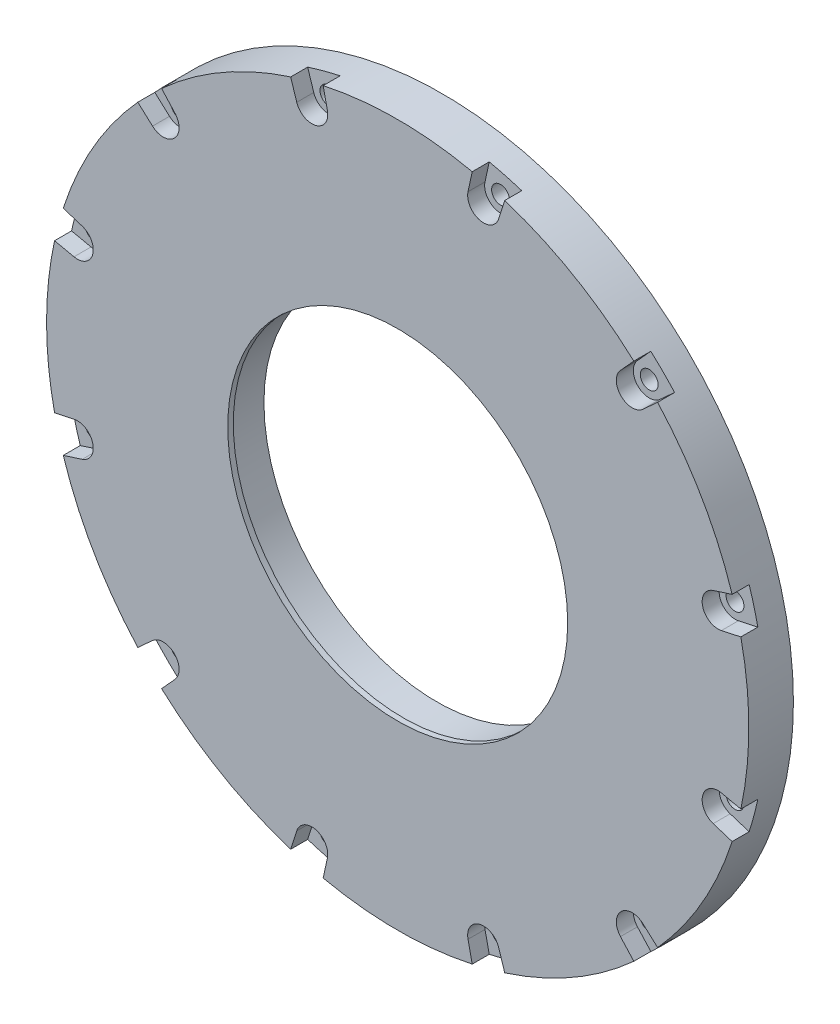
from build123d import *

# Parameters (mm, degrees)
CYC_MASTER_SKETCH_R          = 39.15
BOSS_EXTRUDE1_DEPTH          = 8
SKETCH3_R                    = 1.575
PIN_CUTOUT_DEPTH             = 4
SKETCH5_R                    = 31
CUT_EXTRUDE2_DEPTH           = 56.941442598
BOSS_EXTRUDE2_START          = -1
SKETCH6_R                    = 31
SKETCH6_R_2                  = 30.5
BOSS_EXTRUDE2_DEPTH          = 1
SKETCH7_R                    = 63
SKETCH7_R_2                  = 39.15
BOSS_EXTRUDE3_DEPTH          = 8
SKETCH8_R                    = 36.5
CUT_EXTRUDE3_DEPTH           = 1
M3_START                     = -8
SKETCH9_R                    = 2.1
M3_L5_7_INSERT_CUTOUT_DEPTH  = 6
SKETCH19_R                   = 1.6
M3_THRU_DEPTH                = 90.453898741
M3_START_2                   = -3.05
M3_SOCKET_HEAD_CAP_CUT_DEPTH = 3.05


with BuildPart() as part:
    # CYC Master Sketch → Boss-Extrude1 (new body)
    with BuildSketch(Plane.XY.offset(19)):
        Circle(CYC_MASTER_SKETCH_R)
    extrude(amount=BOSS_EXTRUDE1_DEPTH)

    # Sketch3 → Pin Cutout (cut)
    with BuildSketch(Plane(origin=(0, 0, 19), x_dir=(-1, 0, 0), z_dir=(0, 0, -1))):
        with Locations((-33.5, 0)):
            Circle(SKETCH3_R)
        with Locations((-32.358515181, 8.670438011)):
            Circle(SKETCH3_R)
        with Locations((-29.011851027, 16.75)):
            Circle(SKETCH3_R)
        with Locations((-23.68807717, 23.68807717)):
            Circle(SKETCH3_R)
        with Locations((-16.75, 29.011851027)):
            Circle(SKETCH3_R)
        with Locations((-8.670438011, 32.358515181)):
            Circle(SKETCH3_R)
        with Locations((0, 33.5)):
            Circle(SKETCH3_R)
        with Locations((8.670438011, 32.358515181)):
            Circle(SKETCH3_R)
        with Locations((16.75, 29.011851027)):
            Circle(SKETCH3_R)
        with Locations((23.68807717, 23.68807717)):
            Circle(SKETCH3_R)
        with Locations((29.011851027, 16.75)):
            Circle(SKETCH3_R)
        with Locations((32.358515181, 8.670438011)):
            Circle(SKETCH3_R)
        with Locations((33.5, 0)):
            Circle(SKETCH3_R)
        with Locations((32.358515181, -8.670438011)):
            Circle(SKETCH3_R)
        with Locations((29.011851027, -16.75)):
            Circle(SKETCH3_R)
        with Locations((23.68807717, -23.68807717)):
            Circle(SKETCH3_R)
        with Locations((16.75, -29.011851027)):
            Circle(SKETCH3_R)
        with Locations((8.670438011, -32.358515181)):
            Circle(SKETCH3_R)
        with Locations((0, -33.5)):
            Circle(SKETCH3_R)
        with Locations((-8.670438011, -32.358515181)):
            Circle(SKETCH3_R)
        with Locations((-16.75, -29.011851027)):
            Circle(SKETCH3_R)
        with Locations((-23.68807717, -23.68807717)):
            Circle(SKETCH3_R)
        with Locations((-29.011851027, -16.75)):
            Circle(SKETCH3_R)
        with Locations((-32.358515181, -8.670438011)):
            Circle(SKETCH3_R)
    extrude(amount=-PIN_CUTOUT_DEPTH, mode=Mode.SUBTRACT)

    # Sketch5 → Cut-Extrude2 (cut, through all)
    with BuildSketch(Plane(origin=(0, 0, 19), x_dir=(-1, 0, 0), z_dir=(0, 0, -1))):
        Circle(SKETCH5_R)
    extrude(amount=-CUT_EXTRUDE2_DEPTH, mode=Mode.SUBTRACT)

    # Sketch6 → Boss-Extrude2 (add)
    with BuildSketch(Plane.XY.offset(27).offset(BOSS_EXTRUDE2_START)):
        with Locations(Location((0, 0, 0), (0, 0, 180))):
            Circle(SKETCH6_R)
        Circle(SKETCH6_R_2, mode=Mode.SUBTRACT)
    extrude(amount=BOSS_EXTRUDE2_DEPTH)

    # Sketch7 → Boss-Extrude3 (add)
    with BuildSketch(Plane(origin=(0, 0, 19), x_dir=(-1, 0, 0), z_dir=(0, 0, -1))):
        Circle(SKETCH7_R)
        Circle(SKETCH7_R_2, mode=Mode.SUBTRACT)
    extrude(amount=-BOSS_EXTRUDE3_DEPTH)

    # Sketch8 → Cut-Extrude3 (cut)
    with BuildSketch(Plane(origin=(0, 0, 19), x_dir=(-1, 0, 0), z_dir=(0, 0, -1))):
        Circle(SKETCH8_R)
    extrude(amount=-CUT_EXTRUDE3_DEPTH, mode=Mode.SUBTRACT)

    # Sketch9 → M3 L5.7 Insert Cutout (cut)
    with BuildSketch(Plane.XY.offset(27).offset(M3_START)):
        with Locations(Location((-33.028693287, -13.680932707, 0), (0, 0, 131.860967074))):
            Circle(SKETCH9_R)
        with Locations(Location((-28.362381915, -21.763221087, 0), (0, 0, 146.860967074))):
            Circle(SKETCH9_R)
        with Locations(Location((-28.362381915, 21.763221087, 0), (0, 0, 213.139032926))):
            Circle(SKETCH9_R)
        with Locations(Location((-33.028693287, 13.680932707, 0), (0, 0, 228.139032926))):
            Circle(SKETCH9_R)
        with Locations(Location((4.666311372, 35.444153794, 0), (0, 0, 153.139032926))):
            Circle(SKETCH9_R)
        with Locations(Location((-4.666311372, 35.444153794, 0), (0, 0, 168.139032926))):
            Circle(SKETCH9_R)
        with Locations(Location((33.028693287, 13.680932707, 0), (0, 0, 93.139032926))):
            Circle(SKETCH9_R)
        with Locations(Location((28.362381915, 21.763221087, 0), (0, 0, 108.139032926))):
            Circle(SKETCH9_R)
        with Locations(Location((28.362381915, -21.763221087, 0), (0, 0, 251.860967074))):
            Circle(SKETCH9_R)
        with Locations(Location((33.028693287, -13.680932707, 0), (0, 0, 266.860967074))):
            Circle(SKETCH9_R)
        with Locations(Location((-4.666311372, -35.444153794, 0), (0, 0, 191.860967074))):
            Circle(SKETCH9_R)
        with Locations(Location((4.666311372, -35.444153794, 0), (0, 0, 206.860967074))):
            Circle(SKETCH9_R)
    extrude(amount=M3_L5_7_INSERT_CUTOUT_DEPTH, mode=Mode.SUBTRACT)

    # Sketch19 → M3 Thru (cut, through all)
    with BuildSketch(Plane.XY.offset(27)):
        with Locations((57.472586664, 15.399733184)):
            Circle(SKETCH19_R)
        with Locations((57.472586664, -15.399733184)):
            Circle(SKETCH19_R)
        with Locations((42.072853481, -42.072853481)):
            Circle(SKETCH19_R)
        with Locations((15.399733184, -57.472586664)):
            Circle(SKETCH19_R)
        with Locations((-15.399733184, -57.472586664)):
            Circle(SKETCH19_R)
        with Locations((-42.072853481, -42.072853481)):
            Circle(SKETCH19_R)
        with Locations((-57.472586664, -15.399733184)):
            Circle(SKETCH19_R)
        with Locations((-57.472586664, 15.399733184)):
            Circle(SKETCH19_R)
        with Locations((-42.072853481, 42.072853481)):
            Circle(SKETCH19_R)
        with Locations((-15.399733184, 57.472586664)):
            Circle(SKETCH19_R)
        with Locations((15.399733184, 57.472586664)):
            Circle(SKETCH19_R)
        with Locations((42.072853481, 42.072853481)):
            Circle(SKETCH19_R)
    extrude(amount=-M3_THRU_DEPTH, mode=Mode.SUBTRACT)

    # Sketch20 → M3 Socket Head Cap Cut (cut)
    with BuildSketch(Plane.XY.offset(27).offset(M3_START_2)):
        with BuildLine():
            Line((56.603938009, 18.114129896), (60.002453647, 19.20170712))
            ThreePointArc((60.002453647, 19.20170712), (60.853327056, 16.305599841), (61.564502708, 13.372060662))
            Line((61.564502708, 13.372060662), (58.077513218, 12.614672347))
            ThreePointArc((58.077513218, 12.614672347), (54.719698059, 14.662098905), (56.603938009, 18.114129896))
        make_face()
        with BuildLine():
            Line((58.077513218, -12.614672347), (61.564502708, -13.372060662))
            ThreePointArc((61.564502708, -13.372060662), (60.853327056, -16.305599841), (60.002453647, -19.20170712))
            Line((60.002453647, -19.20170712), (56.603938009, -18.114129896))
            ThreePointArc((56.603938009, -18.114129896), (54.719698059, -14.662098905), (58.077513218, -12.614672347))
        make_face()
        with BuildLine():
            Line((43.989265662, -39.963383322), (46.630392985, -42.362795588))
            ThreePointArc((46.630392985, -42.362795588), (44.547727215, -44.547727215), (42.362795588, -46.630392985))
            Line((42.362795588, -46.630392985), (39.963383322, -43.989265662))
            ThreePointArc((39.963383322, -43.989265662), (40.057599154, -40.057599154), (43.989265662, -39.963383322))
        make_face()
        with BuildLine():
            Line((18.114129896, -56.603938009), (19.20170712, -60.002453647))
            ThreePointArc((19.20170712, -60.002453647), (16.305599841, -60.853327056), (13.372060662, -61.564502708))
            Line((13.372060662, -61.564502708), (12.614672347, -58.077513218))
            ThreePointArc((12.614672347, -58.077513218), (14.662098905, -54.719698059), (18.114129896, -56.603938009))
        make_face()
        with BuildLine():
            Line((-12.614672347, -58.077513218), (-13.372060662, -61.564502708))
            ThreePointArc((-13.372060662, -61.564502708), (-16.305599841, -60.853327056), (-19.20170712, -60.002453647))
            Line((-19.20170712, -60.002453647), (-18.114129896, -56.603938009))
            ThreePointArc((-18.114129896, -56.603938009), (-14.662098905, -54.719698059), (-12.614672347, -58.077513218))
        make_face()
        with BuildLine():
            Line((-39.963383322, -43.989265662), (-42.362795588, -46.630392985))
            ThreePointArc((-42.362795588, -46.630392985), (-44.547727215, -44.547727215), (-46.630392985, -42.362795588))
            Line((-46.630392985, -42.362795588), (-43.989265662, -39.963383322))
            ThreePointArc((-43.989265662, -39.963383322), (-40.057599154, -40.057599154), (-39.963383322, -43.989265662))
        make_face()
        with BuildLine():
            Line((-56.603938009, -18.114129896), (-60.002453647, -19.20170712))
            ThreePointArc((-60.002453647, -19.20170712), (-60.853327056, -16.305599841), (-61.564502708, -13.372060662))
            Line((-61.564502708, -13.372060662), (-58.077513218, -12.614672347))
            ThreePointArc((-58.077513218, -12.614672347), (-54.719698059, -14.662098905), (-56.603938009, -18.114129896))
        make_face()
        with BuildLine():
            Line((-58.077513218, 12.614672347), (-61.564502708, 13.372060662))
            ThreePointArc((-61.564502708, 13.372060662), (-60.853327056, 16.305599841), (-60.002453647, 19.20170712))
            Line((-60.002453647, 19.20170712), (-56.603938009, 18.114129896))
            ThreePointArc((-56.603938009, 18.114129896), (-54.719698059, 14.662098905), (-58.077513218, 12.614672347))
        make_face()
        with BuildLine():
            Line((-43.989265662, 39.963383322), (-46.630392985, 42.362795588))
            ThreePointArc((-46.630392985, 42.362795588), (-44.547727215, 44.547727215), (-42.362795588, 46.630392985))
            Line((-42.362795588, 46.630392985), (-39.963383322, 43.989265662))
            ThreePointArc((-39.963383322, 43.989265662), (-40.057599154, 40.057599154), (-43.989265662, 39.963383322))
        make_face()
        with BuildLine():
            Line((-18.114129896, 56.603938009), (-19.20170712, 60.002453647))
            ThreePointArc((-19.20170712, 60.002453647), (-16.305599841, 60.853327056), (-13.372060662, 61.564502708))
            Line((-13.372060662, 61.564502708), (-12.614672347, 58.077513218))
            ThreePointArc((-12.614672347, 58.077513218), (-14.662098905, 54.719698059), (-18.114129896, 56.603938009))
        make_face()
        with BuildLine():
            Line((12.614672347, 58.077513218), (13.372060662, 61.564502708))
            ThreePointArc((13.372060662, 61.564502708), (16.305599841, 60.853327056), (19.20170712, 60.002453647))
            Line((19.20170712, 60.002453647), (18.114129896, 56.603938009))
            ThreePointArc((18.114129896, 56.603938009), (14.662098905, 54.719698059), (12.614672347, 58.077513218))
        make_face()
        with BuildLine():
            Line((39.963383322, 43.989265662), (42.362795588, 46.630392985))
            ThreePointArc((42.362795588, 46.630392985), (44.547727215, 44.547727215), (46.630392985, 42.362795588))
            Line((46.630392985, 42.362795588), (43.989265662, 39.963383322))
            ThreePointArc((43.989265662, 39.963383322), (40.057599154, 40.057599154), (39.963383322, 43.989265662))
        make_face()
    extrude(amount=M3_SOCKET_HEAD_CAP_CUT_DEPTH, mode=Mode.SUBTRACT)


solid = part.part
